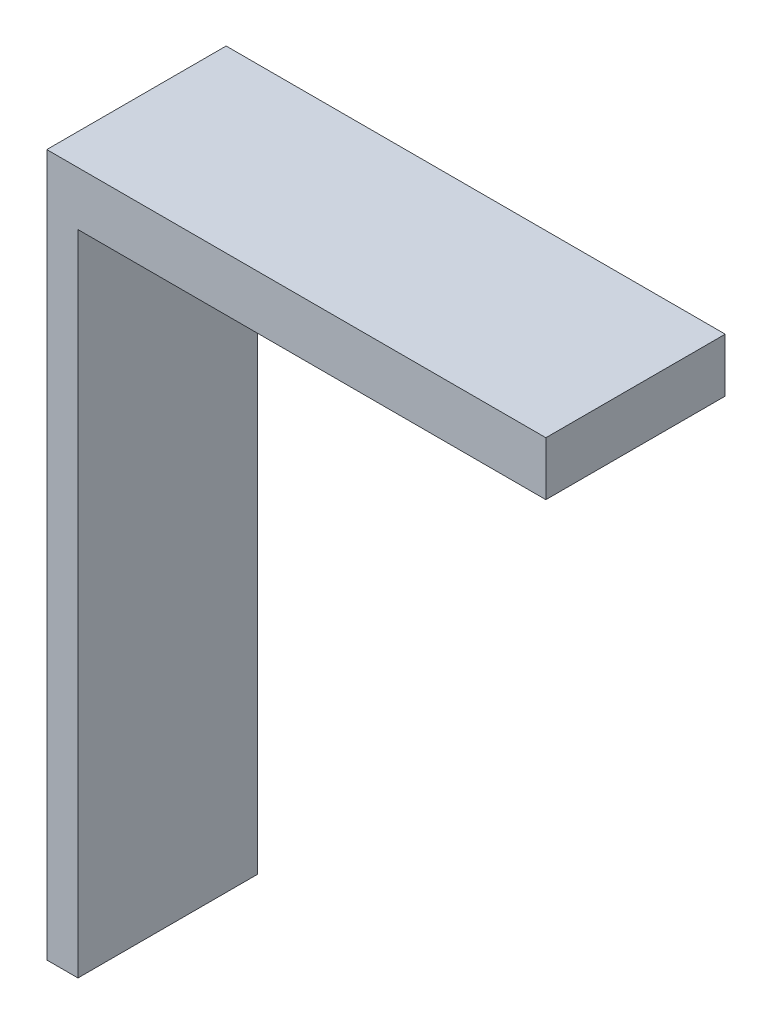
from build123d import *

# Parameters (mm, degrees)
SKETCH1_W           = 4
SKETCH1_H           = 90
BOSS_EXTRUDE1_DEPTH = 23
SKETCH2_W           = 23
SKETCH2_H           = 6.883450807
BOSS_EXTRUDE2_DEPTH = 60


with BuildPart() as part:
    # Sketch1 → Boss-Extrude1 (new body)
    with BuildSketch(Plane.XY):
        Rectangle(SKETCH1_W, SKETCH1_H)
    extrude(amount=BOSS_EXTRUDE1_DEPTH)

    # Sketch2 → Boss-Extrude2 (add)
    with BuildSketch(Plane(origin=(2, 0, 0), x_dir=(0, 0, -1), z_dir=(1, 0, 0))):
        with Locations((-11.5, 41.558274596)):
            Rectangle(SKETCH2_W, SKETCH2_H)
    extrude(amount=BOSS_EXTRUDE2_DEPTH)


solid = part.part
